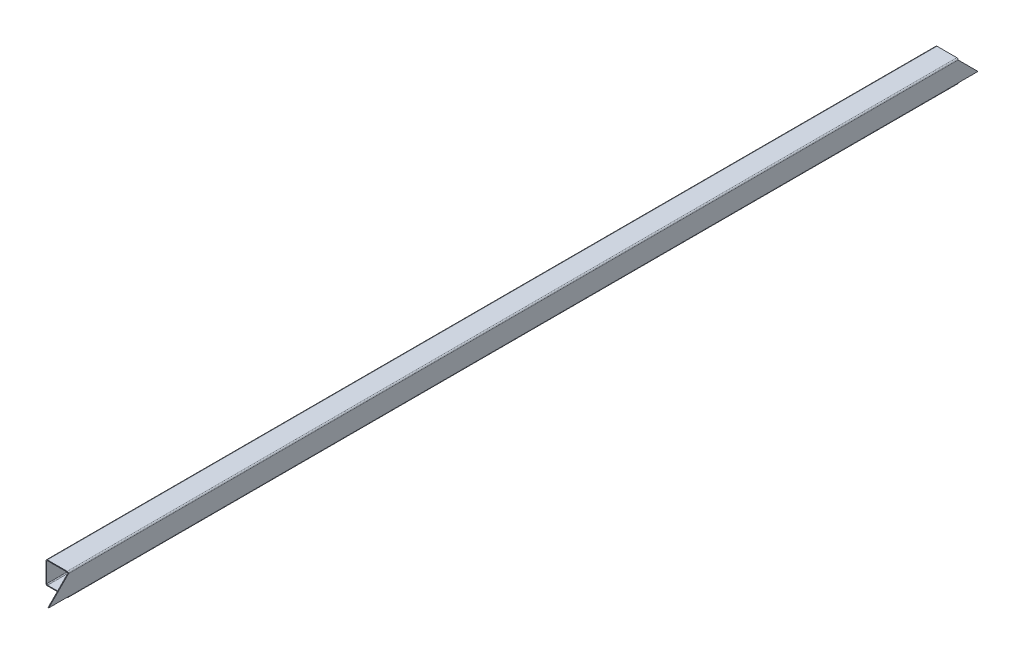
from build123d import *

# Parameters (mm, degrees)
EXTRUDE_1_DEPTH = 3950
EXTRUDE_2_DEPTH = 3


with BuildPart() as part:
    # Эскиз1 → Бобышка-Вытянуть1 (new body)
    with BuildSketch(Plane.XY):
        with BuildLine():
            Line((-44, 50), (44, 50))
            ThreePointArc((44, 50), (48.242640687, 48.242640687), (50, 44))
            Line((50, 44), (50, -44))
            ThreePointArc((50, -44), (48.242640687, -48.242640687), (44, -50))
            Line((44, -50), (-44, -50))
            ThreePointArc((-44, -50), (-48.242640687, -48.242640687), (-50, -44))
            Line((-50, -44), (-50, 44))
            ThreePointArc((-50, 44), (-48.242640687, 48.242640687), (-44, 50))
        make_face()
        with BuildLine():
            Line((-43, 47), (43, 47))
            ThreePointArc((43, 47), (45.828427125, 45.828427125), (47, 43))
            Line((47, 43), (47, -43))
            ThreePointArc((47, -43), (45.828427125, -45.828427125), (43, -47))
            Line((43, -47), (-43, -47))
            ThreePointArc((-43, -47), (-45.828427125, -45.828427125), (-47, -43))
            Line((-47, -43), (-47, 43))
            ThreePointArc((-47, 43), (-45.828427125, 45.828427125), (-43, 47))
        make_face(mode=Mode.SUBTRACT)
    extrude(amount=-EXTRUDE_1_DEPTH)

    # Эскиз2 → Бобышка-Вытянуть2 (add)
    with BuildSketch(Plane(origin=(50, 0, 0), x_dir=(0, 0, -1), z_dir=(1, 0, 0))):
        Polygon((0, -44), (0, 44), (-88, -44), align=None)
        Polygon((3950, -44), (3950, 44), (4038, -44), align=None)
    extrude(amount=-EXTRUDE_2_DEPTH)


solid = part.part
